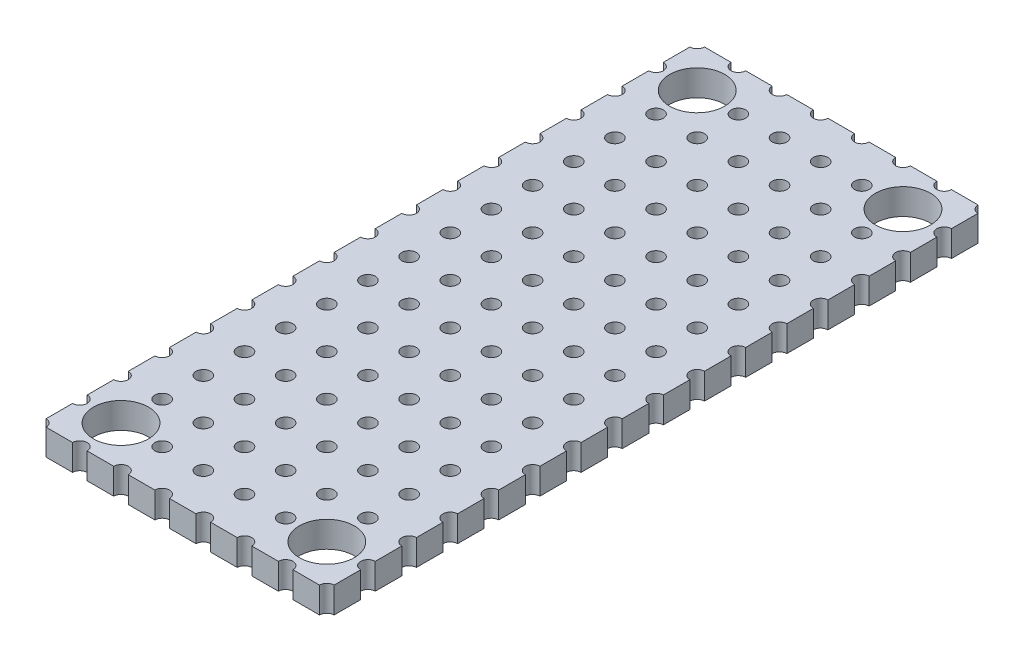
from build123d import *

# Parameters (mm, degrees)
ESQUISSE1_W             = 17.78
ESQUISSE1_H             = 40.64
BOSS_EXTRU_1_DEPTH      = 1.6
ESQUISSE2_R             = 0.45
ENL_V_MAT_EXTRU_1_DEPTH = 40.65857049
D_GAGEMENT_M31_D        = 3.4


with BuildPart() as part:
    # Esquisse1 → Boss.-Extru.1 (new body)
    with BuildSketch(Plane(origin=(0, 0, 0), x_dir=(1, 0, 0), z_dir=(0, 1, 0))):
        with Locations((5.005294118, -16.790147059)):
            Rectangle(ESQUISSE1_W, ESQUISSE1_H)
    extrude(amount=BOSS_EXTRU_1_DEPTH)

    # Esquisse2 → Enlèv. mat.-Extru.1 (cut, through all)
    with BuildSketch(Plane(origin=(0, 1.6, 0), x_dir=(1, 0, 0), z_dir=(0, 1, 0))):
        with Locations((-3.884705882, 3.529852941)):
            Circle(ESQUISSE2_R)
        with Locations((-1.344705882, 3.529852941)):
            Circle(ESQUISSE2_R)
        with Locations((1.195294118, 3.529852941)):
            Circle(ESQUISSE2_R)
        with Locations((3.735294118, 3.529852941)):
            Circle(ESQUISSE2_R)
        with Locations(Location((-1.344705882, 0.989852941, 0), (0, 0, 270))):
            Circle(ESQUISSE2_R)
        with Locations(Location((1.195294118, 0.989852941, 0), (0, 0, 270))):
            Circle(ESQUISSE2_R)
        with Locations(Location((3.735294118, 0.989852941, 0), (0, 0, 270))):
            Circle(ESQUISSE2_R)
        with Locations(Location((-1.344705882, -1.550147059, 0), (0, 0, 270))):
            Circle(ESQUISSE2_R)
        with Locations(Location((1.195294118, -1.550147059, 0), (0, 0, 270))):
            Circle(ESQUISSE2_R)
        with Locations(Location((3.735294118, -1.550147059, 0), (0, 0, 270))):
            Circle(ESQUISSE2_R)
        with Locations(Location((-1.344705882, -4.090147059, 0), (0, 0, 270))):
            Circle(ESQUISSE2_R)
        with Locations(Location((1.195294118, -4.090147059, 0), (0, 0, 270))):
            Circle(ESQUISSE2_R)
        with Locations(Location((3.735294118, -4.090147059, 0), (0, 0, 270))):
            Circle(ESQUISSE2_R)
        with Locations(Location((-1.344705882, -6.630147059, 0), (0, 0, 270))):
            Circle(ESQUISSE2_R)
        with Locations(Location((1.195294118, -6.630147059, 0), (0, 0, 270))):
            Circle(ESQUISSE2_R)
        with Locations(Location((3.735294118, -6.630147059, 0), (0, 0, 270))):
            Circle(ESQUISSE2_R)
        with Locations(Location((-1.344705882, -9.170147059, 0), (0, 0, 270))):
            Circle(ESQUISSE2_R)
        with Locations(Location((1.195294118, -9.170147059, 0), (0, 0, 270))):
            Circle(ESQUISSE2_R)
        with Locations(Location((3.735294118, -9.170147059, 0), (0, 0, 270))):
            Circle(ESQUISSE2_R)
        with Locations(Location((-1.344705882, -11.710147059, 0), (0, 0, 270))):
            Circle(ESQUISSE2_R)
        with Locations(Location((1.195294118, -11.710147059, 0), (0, 0, 270))):
            Circle(ESQUISSE2_R)
        with Locations(Location((3.735294118, -11.710147059, 0), (0, 0, 270))):
            Circle(ESQUISSE2_R)
        with Locations(Location((-1.344705882, -14.250147059, 0), (0, 0, 270))):
            Circle(ESQUISSE2_R)
        with Locations(Location((1.195294118, -14.250147059, 0), (0, 0, 270))):
            Circle(ESQUISSE2_R)
        with Locations(Location((3.735294118, -14.250147059, 0), (0, 0, 270))):
            Circle(ESQUISSE2_R)
        with Locations((-3.884705882, 0.989852941)):
            Circle(ESQUISSE2_R)
        with Locations((-3.884705882, -1.550147059)):
            Circle(ESQUISSE2_R)
        with Locations((-3.884705882, -4.090147059)):
            Circle(ESQUISSE2_R)
        with Locations((-3.884705882, -6.630147059)):
            Circle(ESQUISSE2_R)
        with Locations((-3.884705882, -9.170147059)):
            Circle(ESQUISSE2_R)
        with Locations((-3.884705882, -11.710147059)):
            Circle(ESQUISSE2_R)
        with Locations((-3.884705882, -14.250147059)):
            Circle(ESQUISSE2_R)
        with Locations((6.275294118, 3.529852941)):
            Circle(ESQUISSE2_R)
        with Locations(Location((6.275294118, 0.989852941, 0), (0, 0, 270))):
            Circle(ESQUISSE2_R)
        with Locations(Location((6.275294118, -1.550147059, 0), (0, 0, 270))):
            Circle(ESQUISSE2_R)
        with Locations(Location((6.275294118, -4.090147059, 0), (0, 0, 270))):
            Circle(ESQUISSE2_R)
        with Locations(Location((6.275294118, -6.630147059, 0), (0, 0, 270))):
            Circle(ESQUISSE2_R)
        with Locations(Location((6.275294118, -9.170147059, 0), (0, 0, 270))):
            Circle(ESQUISSE2_R)
        with Locations(Location((6.275294118, -11.710147059, 0), (0, 0, 270))):
            Circle(ESQUISSE2_R)
        with Locations(Location((6.275294118, -14.250147059, 0), (0, 0, 270))):
            Circle(ESQUISSE2_R)
        with Locations((-3.884705882, -16.790147059)):
            Circle(ESQUISSE2_R)
        with Locations(Location((-1.344705882, -16.790147059, 0), (0, 0, 270))):
            Circle(ESQUISSE2_R)
        with Locations(Location((1.195294118, -16.790147059, 0), (0, 0, 270))):
            Circle(ESQUISSE2_R)
        with Locations(Location((3.735294118, -16.790147059, 0), (0, 0, 270))):
            Circle(ESQUISSE2_R)
        with Locations(Location((6.275294118, -16.790147059, 0), (0, 0, 270))):
            Circle(ESQUISSE2_R)
        with Locations((8.815294118, 3.529852941)):
            Circle(ESQUISSE2_R)
        with Locations((11.355294118, 3.529852941)):
            Circle(ESQUISSE2_R)
        with Locations((13.895294118, 3.529852941)):
            Circle(ESQUISSE2_R)
        with Locations((16.435294118, 3.529852941)):
            Circle(ESQUISSE2_R)
        with Locations((18.975294118, 3.529852941)):
            Circle(ESQUISSE2_R)
        with Locations(Location((8.815294118, 0.989852941, 0), (0, 0, 270))):
            Circle(ESQUISSE2_R)
        with Locations(Location((11.355294118, 0.989852941, 0), (0, 0, 270))):
            Circle(ESQUISSE2_R)
        with Locations((13.895294118, 0.989852941)):
            Circle(ESQUISSE2_R)
        with Locations((16.435294118, 0.989852941)):
            Circle(ESQUISSE2_R)
        with Locations((18.975294118, 0.989852941)):
            Circle(ESQUISSE2_R)
        with Locations(Location((8.815294118, -1.550147059, 0), (0, 0, 270))):
            Circle(ESQUISSE2_R)
        with Locations(Location((11.355294118, -1.550147059, 0), (0, 0, 270))):
            Circle(ESQUISSE2_R)
        with Locations((13.895294118, -1.550147059)):
            Circle(ESQUISSE2_R)
        with Locations((16.435294118, -1.550147059)):
            Circle(ESQUISSE2_R)
        with Locations((18.975294118, -1.550147059)):
            Circle(ESQUISSE2_R)
        with Locations(Location((8.815294118, -4.090147059, 0), (0, 0, 270))):
            Circle(ESQUISSE2_R)
        with Locations(Location((11.355294118, -4.090147059, 0), (0, 0, 270))):
            Circle(ESQUISSE2_R)
        with Locations((13.895294118, -4.090147059)):
            Circle(ESQUISSE2_R)
        with Locations((16.435294118, -4.090147059)):
            Circle(ESQUISSE2_R)
        with Locations((18.975294118, -4.090147059)):
            Circle(ESQUISSE2_R)
        with Locations(Location((8.815294118, -6.630147059, 0), (0, 0, 270))):
            Circle(ESQUISSE2_R)
        with Locations(Location((11.355294118, -6.630147059, 0), (0, 0, 270))):
            Circle(ESQUISSE2_R)
        with Locations((13.895294118, -6.630147059)):
            Circle(ESQUISSE2_R)
        with Locations((16.435294118, -6.630147059)):
            Circle(ESQUISSE2_R)
        with Locations((18.975294118, -6.630147059)):
            Circle(ESQUISSE2_R)
        with Locations(Location((8.815294118, -9.170147059, 0), (0, 0, 270))):
            Circle(ESQUISSE2_R)
        with Locations(Location((11.355294118, -9.170147059, 0), (0, 0, 270))):
            Circle(ESQUISSE2_R)
        with Locations((13.895294118, -9.170147059)):
            Circle(ESQUISSE2_R)
        with Locations((16.435294118, -9.170147059)):
            Circle(ESQUISSE2_R)
        with Locations((18.975294118, -9.170147059)):
            Circle(ESQUISSE2_R)
        with Locations(Location((8.815294118, -11.710147059, 0), (0, 0, 270))):
            Circle(ESQUISSE2_R)
        with Locations(Location((11.355294118, -11.710147059, 0), (0, 0, 270))):
            Circle(ESQUISSE2_R)
        with Locations((13.895294118, -11.710147059)):
            Circle(ESQUISSE2_R)
        with Locations((16.435294118, -11.710147059)):
            Circle(ESQUISSE2_R)
        with Locations((18.975294118, -11.710147059)):
            Circle(ESQUISSE2_R)
        with Locations(Location((8.815294118, -14.250147059, 0), (0, 0, 270))):
            Circle(ESQUISSE2_R)
        with Locations(Location((11.355294118, -14.250147059, 0), (0, 0, 270))):
            Circle(ESQUISSE2_R)
        with Locations((13.895294118, -14.250147059)):
            Circle(ESQUISSE2_R)
        with Locations((16.435294118, -14.250147059)):
            Circle(ESQUISSE2_R)
        with Locations((18.975294118, -14.250147059)):
            Circle(ESQUISSE2_R)
        with Locations(Location((8.815294118, -16.790147059, 0), (0, 0, 270))):
            Circle(ESQUISSE2_R)
        with Locations(Location((11.355294118, -16.790147059, 0), (0, 0, 270))):
            Circle(ESQUISSE2_R)
        with Locations((13.895294118, -16.790147059)):
            Circle(ESQUISSE2_R)
        with Locations((16.435294118, -16.790147059)):
            Circle(ESQUISSE2_R)
        with Locations((18.975294118, -16.790147059)):
            Circle(ESQUISSE2_R)
        with Locations((-3.884705882, -19.330147059)):
            Circle(ESQUISSE2_R)
        with Locations(Location((-1.344705882, -19.330147059, 0), (0, 0, 270))):
            Circle(ESQUISSE2_R)
        with Locations(Location((1.195294118, -19.330147059, 0), (0, 0, 270))):
            Circle(ESQUISSE2_R)
        with Locations(Location((3.735294118, -19.330147059, 0), (0, 0, 270))):
            Circle(ESQUISSE2_R)
        with Locations(Location((6.275294118, -19.330147059, 0), (0, 0, 270))):
            Circle(ESQUISSE2_R)
        with Locations(Location((8.815294118, -19.330147059, 0), (0, 0, 270))):
            Circle(ESQUISSE2_R)
        with Locations(Location((11.355294118, -19.330147059, 0), (0, 0, 270))):
            Circle(ESQUISSE2_R)
        with Locations((13.895294118, -19.330147059)):
            Circle(ESQUISSE2_R)
        with Locations((16.435294118, -19.330147059)):
            Circle(ESQUISSE2_R)
        with Locations((18.975294118, -19.330147059)):
            Circle(ESQUISSE2_R)
        with Locations((-3.884705882, -21.870147059)):
            Circle(ESQUISSE2_R)
        with Locations(Location((-1.344705882, -21.870147059, 0), (0, 0, 270))):
            Circle(ESQUISSE2_R)
        with Locations(Location((1.195294118, -21.870147059, 0), (0, 0, 270))):
            Circle(ESQUISSE2_R)
        with Locations(Location((3.735294118, -21.870147059, 0), (0, 0, 270))):
            Circle(ESQUISSE2_R)
        with Locations(Location((6.275294118, -21.870147059, 0), (0, 0, 270))):
            Circle(ESQUISSE2_R)
        with Locations(Location((8.815294118, -21.870147059, 0), (0, 0, 270))):
            Circle(ESQUISSE2_R)
        with Locations(Location((11.355294118, -21.870147059, 0), (0, 0, 270))):
            Circle(ESQUISSE2_R)
        with Locations((13.895294118, -21.870147059)):
            Circle(ESQUISSE2_R)
        with Locations((16.435294118, -21.870147059)):
            Circle(ESQUISSE2_R)
        with Locations((18.975294118, -21.870147059)):
            Circle(ESQUISSE2_R)
        with Locations((-3.884705882, -24.410147059)):
            Circle(ESQUISSE2_R)
        with Locations(Location((-1.344705882, -24.410147059, 0), (0, 0, 270))):
            Circle(ESQUISSE2_R)
        with Locations(Location((1.195294118, -24.410147059, 0), (0, 0, 270))):
            Circle(ESQUISSE2_R)
        with Locations(Location((3.735294118, -24.410147059, 0), (0, 0, 270))):
            Circle(ESQUISSE2_R)
        with Locations(Location((6.275294118, -24.410147059, 0), (0, 0, 270))):
            Circle(ESQUISSE2_R)
        with Locations(Location((8.815294118, -24.410147059, 0), (0, 0, 270))):
            Circle(ESQUISSE2_R)
        with Locations(Location((11.355294118, -24.410147059, 0), (0, 0, 270))):
            Circle(ESQUISSE2_R)
        with Locations((13.895294118, -24.410147059)):
            Circle(ESQUISSE2_R)
        with Locations((16.435294118, -24.410147059)):
            Circle(ESQUISSE2_R)
        with Locations((18.975294118, -24.410147059)):
            Circle(ESQUISSE2_R)
        with Locations((-3.884705882, -26.950147059)):
            Circle(ESQUISSE2_R)
        with Locations(Location((-1.344705882, -26.950147059, 0), (0, 0, 270))):
            Circle(ESQUISSE2_R)
        with Locations(Location((1.195294118, -26.950147059, 0), (0, 0, 270))):
            Circle(ESQUISSE2_R)
        with Locations(Location((3.735294118, -26.950147059, 0), (0, 0, 270))):
            Circle(ESQUISSE2_R)
        with Locations(Location((6.275294118, -26.950147059, 0), (0, 0, 270))):
            Circle(ESQUISSE2_R)
        with Locations(Location((8.815294118, -26.950147059, 0), (0, 0, 270))):
            Circle(ESQUISSE2_R)
        with Locations(Location((11.355294118, -26.950147059, 0), (0, 0, 270))):
            Circle(ESQUISSE2_R)
        with Locations((13.895294118, -26.950147059)):
            Circle(ESQUISSE2_R)
        with Locations((16.435294118, -26.950147059)):
            Circle(ESQUISSE2_R)
        with Locations((18.975294118, -26.950147059)):
            Circle(ESQUISSE2_R)
        with Locations((-3.884705882, -29.490147059)):
            Circle(ESQUISSE2_R)
        with Locations(Location((-1.344705882, -29.490147059, 0), (0, 0, 270))):
            Circle(ESQUISSE2_R)
        with Locations(Location((1.195294118, -29.490147059, 0), (0, 0, 270))):
            Circle(ESQUISSE2_R)
        with Locations(Location((3.735294118, -29.490147059, 0), (0, 0, 270))):
            Circle(ESQUISSE2_R)
        with Locations(Location((6.275294118, -29.490147059, 0), (0, 0, 270))):
            Circle(ESQUISSE2_R)
        with Locations(Location((8.815294118, -29.490147059, 0), (0, 0, 270))):
            Circle(ESQUISSE2_R)
        with Locations(Location((11.355294118, -29.490147059, 0), (0, 0, 270))):
            Circle(ESQUISSE2_R)
        with Locations((13.895294118, -29.490147059)):
            Circle(ESQUISSE2_R)
        with Locations((16.435294118, -29.490147059)):
            Circle(ESQUISSE2_R)
        with Locations((18.975294118, -29.490147059)):
            Circle(ESQUISSE2_R)
        with Locations((-3.884705882, -32.030147059)):
            Circle(ESQUISSE2_R)
        with Locations(Location((-1.344705882, -32.030147059, 0), (0, 0, 270))):
            Circle(ESQUISSE2_R)
        with Locations(Location((1.195294118, -32.030147059, 0), (0, 0, 270))):
            Circle(ESQUISSE2_R)
        with Locations(Location((3.735294118, -32.030147059, 0), (0, 0, 270))):
            Circle(ESQUISSE2_R)
        with Locations(Location((6.275294118, -32.030147059, 0), (0, 0, 270))):
            Circle(ESQUISSE2_R)
        with Locations(Location((8.815294118, -32.030147059, 0), (0, 0, 270))):
            Circle(ESQUISSE2_R)
        with Locations(Location((11.355294118, -32.030147059, 0), (0, 0, 270))):
            Circle(ESQUISSE2_R)
        with Locations((13.895294118, -32.030147059)):
            Circle(ESQUISSE2_R)
        with Locations((16.435294118, -32.030147059)):
            Circle(ESQUISSE2_R)
        with Locations((18.975294118, -32.030147059)):
            Circle(ESQUISSE2_R)
        with Locations((-3.884705882, -34.570147059)):
            Circle(ESQUISSE2_R)
        with Locations(Location((-1.344705882, -34.570147059, 0), (0, 0, 270))):
            Circle(ESQUISSE2_R)
        with Locations(Location((1.195294118, -34.570147059, 0), (0, 0, 270))):
            Circle(ESQUISSE2_R)
        with Locations(Location((3.735294118, -34.570147059, 0), (0, 0, 270))):
            Circle(ESQUISSE2_R)
        with Locations(Location((6.275294118, -34.570147059, 0), (0, 0, 270))):
            Circle(ESQUISSE2_R)
        with Locations(Location((8.815294118, -34.570147059, 0), (0, 0, 270))):
            Circle(ESQUISSE2_R)
        with Locations(Location((11.355294118, -34.570147059, 0), (0, 0, 270))):
            Circle(ESQUISSE2_R)
        with Locations((13.895294118, -34.570147059)):
            Circle(ESQUISSE2_R)
        with Locations((16.435294118, -34.570147059)):
            Circle(ESQUISSE2_R)
        with Locations((18.975294118, -34.570147059)):
            Circle(ESQUISSE2_R)
        with Locations((-3.884705882, -37.110147059)):
            Circle(ESQUISSE2_R)
        with Locations((-1.344705882, -37.110147059)):
            Circle(ESQUISSE2_R)
        with Locations((1.195294118, -37.110147059)):
            Circle(ESQUISSE2_R)
        with Locations((3.735294118, -37.110147059)):
            Circle(ESQUISSE2_R)
        with Locations((6.275294118, -37.110147059)):
            Circle(ESQUISSE2_R)
        with Locations((8.815294118, -37.110147059)):
            Circle(ESQUISSE2_R)
        with Locations((11.355294118, -37.110147059)):
            Circle(ESQUISSE2_R)
        with Locations((13.895294118, -37.110147059)):
            Circle(ESQUISSE2_R)
        with Locations((16.435294118, -37.110147059)):
            Circle(ESQUISSE2_R)
        with Locations((18.975294118, -37.110147059)):
            Circle(ESQUISSE2_R)
    extrude(amount=-ENL_V_MAT_EXTRU_1_DEPTH, mode=Mode.SUBTRACT)

    # Dégagement M31 (through all)
    with Locations(Plane(origin=(0, 1.6, 0), x_dir=(1, 0, 0), z_dir=(0, 1, 0))):
        with Locations((11.355294118, 0.989852941), (-1.344705882, 0.989852941), (-1.344705882, -34.570147059), (11.355294118, -34.570147059)):
            Hole(D_GAGEMENT_M31_D / 2)


solid = part.part
